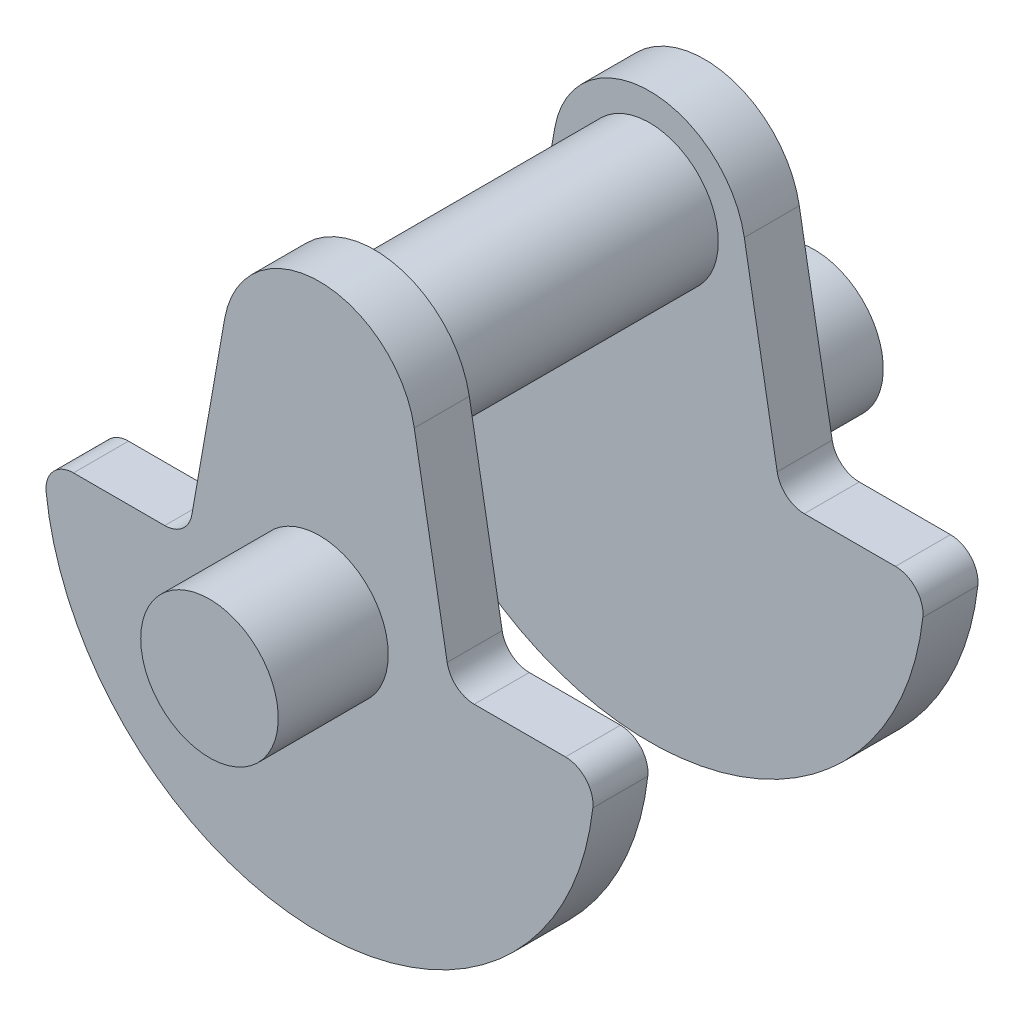
from build123d import *

# Parameters (mm, degrees)
SKETCH1_R               = 12.5
BOSS_EXTRUDE1_DEPTH     = 10
SKETCH2_R               = 12.5
BOSS_EXTRUDE2_DEPTH     = 30
BOSS_EXTRUDE3_START     = -35
SKETCH3_R               = 12.5
BOSS_EXTRUDE3_DEPTH     = 35
MIRROR4_COPY_1_SKETCH_R = 12.5
MIRROR4_COPY_1_DEPTH    = 10
MIRROR4_COPY_2_SKETCH_R = 12.5
MIRROR4_COPY_2_DEPTH    = 30
MIRROR4_START           = -35
MIRROR4_COPY_3_SKETCH_R = 12.5
MIRROR4_COPY_3_DEPTH    = 35
MIRROR4_COPY_4_SKETCH_R = 12.5
MIRROR4_COPY_4_DEPTH    = 10
MIRROR4_COPY_5_SKETCH_R = 12.5
MIRROR4_COPY_5_DEPTH    = 30
MIRROR4_COPY_6_SKETCH_R = 12.5
MIRROR4_COPY_6_DEPTH    = 35


with BuildPart() as part:
    # Sketch1 → Boss-Extrude1 (new body)
    with BuildSketch(Plane.XY):
        with BuildLine():
            Line((-23.212869424, 4.131759112), (-17.234135678, 38.038843109))
            ThreePointArc((-17.234135678, 38.038843109), (0, 52.5), (17.234135678, 38.038843109))
            Line((17.234135678, 38.038843109), (23.212869424, 4.131759112))
            ThreePointArc((23.212869424, 4.131759112), (24.92297014, 1.169777784), (28.136908189, 0))
            Line((28.136908189, 0), (44.72135955, 0))
            ThreePointArc((44.72135955, 0), (48.448139512, -1.666666667), (49.6903995, -5.555555556))
            ThreePointArc((49.6903995, -5.555555556), (0, -50), (-49.6903995, -5.555555556))
            ThreePointArc((-49.6903995, -5.555555556), (-48.448139512, -1.666666667), (-44.72135955, 0))
            Line((-44.72135955, 0), (-28.136908189, 0))
            ThreePointArc((-28.136908189, 0), (-24.92297014, 1.169777784), (-23.212869424, 4.131759112))
        make_face()
        Circle(SKETCH1_R, mode=Mode.SUBTRACT)
        with Locations((0, 35)):
            Circle(SKETCH1_R, mode=Mode.SUBTRACT)
    boss_extrude1 = extrude(amount=BOSS_EXTRUDE1_DEPTH)

    # Sketch2 → Boss-Extrude2 (add)
    with BuildSketch(Plane(origin=(0, 0, 0), x_dir=(-1, 0, 0), z_dir=(0, 0, -1))):
        Circle(SKETCH2_R)
    boss_extrude2 = extrude(amount=-BOSS_EXTRUDE2_DEPTH)

    # Sketch3 → Boss-Extrude3 (add)
    with BuildSketch(Plane.XY.offset(10).offset(BOSS_EXTRUDE3_START)):
        with Locations((0, 35)):
            Circle(SKETCH3_R)
    boss_extrude3 = extrude(amount=BOSS_EXTRUDE3_DEPTH)

    # Mirror4 copy 1 sketch → Mirror4 copy 1 (add)
    with BuildSketch(Plane.XY):
        with BuildLine():
            Line((-23.212869424, 4.131759112), (-17.234135678, 38.038843109))
            ThreePointArc((-17.234135678, 38.038843109), (0, 52.5), (17.234135678, 38.038843109))
            Line((17.234135678, 38.038843109), (23.212869424, 4.131759112))
            ThreePointArc((23.212869424, 4.131759112), (24.92297014, 1.169777784), (28.136908189, 0))
            Line((28.136908189, 0), (44.72135955, 0))
            ThreePointArc((44.72135955, 0), (48.448139512, -1.666666667), (49.6903995, -5.555555556))
            ThreePointArc((49.6903995, -5.555555556), (0, -50), (-49.6903995, -5.555555556))
            ThreePointArc((-49.6903995, -5.555555556), (-48.448139512, -1.666666667), (-44.72135955, 0))
            Line((-44.72135955, 0), (-28.136908189, 0))
            ThreePointArc((-28.136908189, 0), (-24.92297014, 1.169777784), (-23.212869424, 4.131759112))
        make_face()
        Circle(MIRROR4_COPY_1_SKETCH_R, mode=Mode.SUBTRACT)
        with Locations((0, 35)):
            Circle(MIRROR4_COPY_1_SKETCH_R, mode=Mode.SUBTRACT)
    extrude(amount=MIRROR4_COPY_1_DEPTH)

    # Mirror4 copy 2 sketch → Mirror4 copy 2 (add)
    with BuildSketch(Plane(origin=(0, 0, 0), x_dir=(-1, 0, 0), z_dir=(0, 0, -1))):
        Circle(MIRROR4_COPY_2_SKETCH_R)
    extrude(amount=-MIRROR4_COPY_2_DEPTH)



with BuildPart() as mirror3_1:
    # Mirror3: Boss-Extrude1, Boss-Extrude2, Boss-Extrude3 across plane
    add(boss_extrude1.mirror(Plane(origin=(0, 0, -25), x_dir=(1, 0, 0), z_dir=(0, 0, -1))))
    add(boss_extrude2.mirror(Plane(origin=(0, 0, -25), x_dir=(1, 0, 0), z_dir=(0, 0, -1))))
    add(boss_extrude3.mirror(Plane(origin=(0, 0, -25), x_dir=(1, 0, 0), z_dir=(0, 0, -1))))


with BuildPart() as part_1:
    add(part.part)

    add(mirror3_1.part)  # Mirror4 copy 3 merges Mirror3_1
    # Mirror4 copy 3 sketch → Mirror4 copy 3 (add)
    with BuildSketch(Plane.XY.offset(10).offset(MIRROR4_START)):
        with Locations((0, 35)):
            Circle(MIRROR4_COPY_3_SKETCH_R)
    extrude(amount=MIRROR4_COPY_3_DEPTH)

    # Mirror4 copy 4 sketch → Mirror4 copy 4 (add)
    with BuildSketch(Plane(origin=(0, 0, -50), x_dir=(1, 0, 0), z_dir=(0, 0, -1))):
        with BuildLine():
            Line((-23.212869424, -4.131759112), (-17.234135678, -38.038843109))
            ThreePointArc((-17.234135678, -38.038843109), (0, -52.5), (17.234135678, -38.038843109))
            Line((17.234135678, -38.038843109), (23.212869424, -4.131759112))
            ThreePointArc((23.212869424, -4.131759112), (24.92297014, -1.169777784), (28.136908189, 0))
            Line((28.136908189, 0), (44.72135955, 0))
            ThreePointArc((44.72135955, 0), (48.448139512, 1.666666667), (49.6903995, 5.555555556))
            ThreePointArc((49.6903995, 5.555555556), (0, 50), (-49.6903995, 5.555555556))
            ThreePointArc((-49.6903995, 5.555555556), (-48.448139512, 1.666666667), (-44.72135955, 0))
            Line((-44.72135955, 0), (-28.136908189, 0))
            ThreePointArc((-28.136908189, 0), (-24.92297014, -1.169777784), (-23.212869424, -4.131759112))
        make_face()
        Circle(MIRROR4_COPY_4_SKETCH_R, mode=Mode.SUBTRACT)
        with Locations((0, -35)):
            Circle(MIRROR4_COPY_4_SKETCH_R, mode=Mode.SUBTRACT)
    extrude(amount=MIRROR4_COPY_4_DEPTH)

    # Mirror4 copy 5 sketch → Mirror4 copy 5 (add)
    with BuildSketch(Plane(origin=(0, 0, -50), x_dir=(-1, 0, 0), z_dir=(0, 0, 1))):
        Circle(MIRROR4_COPY_5_SKETCH_R)
    extrude(amount=-MIRROR4_COPY_5_DEPTH)

    # Mirror4 copy 6 sketch → Mirror4 copy 6 (add)
    with BuildSketch(Plane(origin=(0, 0, -60), x_dir=(1, 0, 0), z_dir=(0, 0, -1)).offset(MIRROR4_START)):
        with Locations((0, -35)):
            Circle(MIRROR4_COPY_6_SKETCH_R)
    extrude(amount=MIRROR4_COPY_6_DEPTH)


solid = part_1.part
